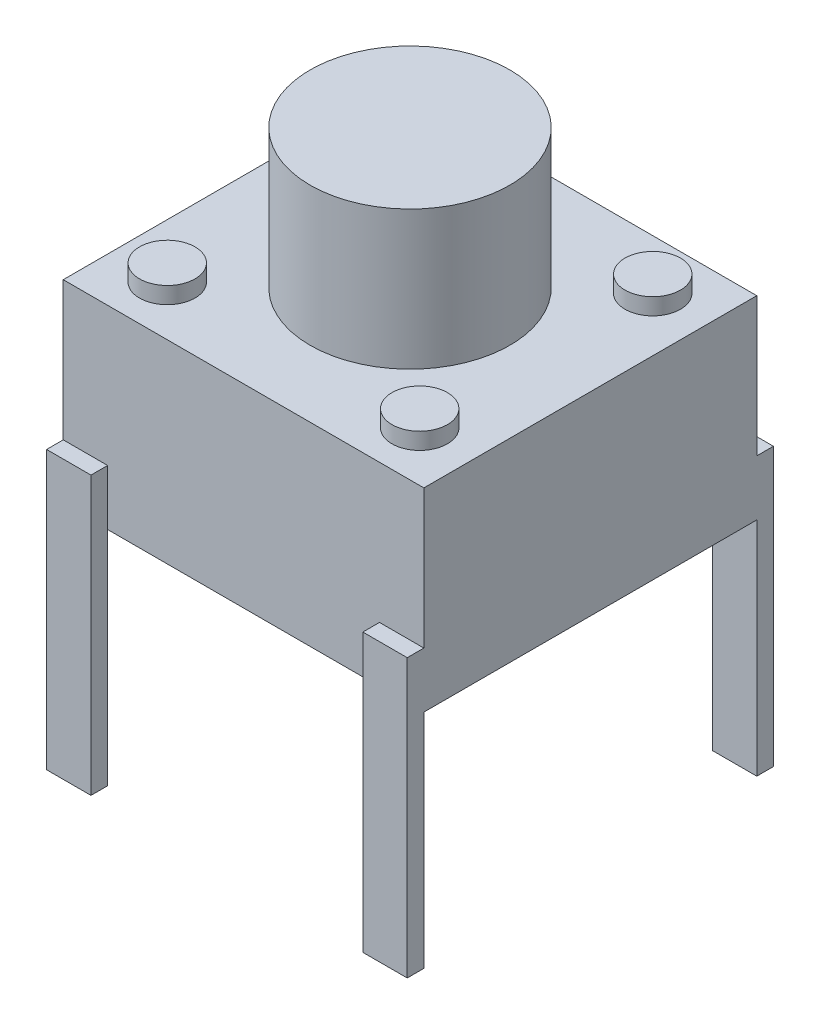
from build123d import *

# Parameters (mm, degrees)
SKETCH_1_W      = 6.5
SKETCH_1_H      = 6
EXTRUDE_1_DEPTH = 3.5
SKETCH_1_3_R    = 1.8
EXTRUDE_2_DEPTH = 6
EXTRUDE_START   = 3.5
SKETCH_1_4_R    = 0.5
EXTRUDE_3_DEPTH = 0.3
EXTRUDE_START_2 = -1
SKETCH_2_W      = 0.8
SKETCH_2_H      = 0.3
EXTRUDE_4_DEPTH = 5


with BuildPart() as part:
    # 草图1 → 凸台-拉伸1 (new body)
    with BuildSketch(Plane(origin=(0, 0, 0), x_dir=(1, 0, 0), z_dir=(0, 1, 0))):
        Rectangle(SKETCH_1_W, SKETCH_1_H)
    extrude(amount=EXTRUDE_1_DEPTH)

    # 草图1<3> → 凸台-拉伸2 (add)
    with BuildSketch(Plane(origin=(0, 0, 0), x_dir=(1, 0, 0), z_dir=(0, 1, 0))):
        with Locations(Location((0, 0, 0), (0, 0, 90))):
            Circle(SKETCH_1_3_R)
    extrude(amount=EXTRUDE_2_DEPTH)

    # 草图1<4> → 凸台-拉伸3 (add)
    with BuildSketch(Plane(origin=(0, 0, 0), x_dir=(1, 0, 0), z_dir=(0, 1, 0)).offset(EXTRUDE_START)):
        with Locations(Location((-2.275, 2.1, 0), (0, 0, 90))):
            Circle(SKETCH_1_4_R)
        with Locations(Location((-2.275, -2.1, 0), (0, 0, 90))):
            Circle(SKETCH_1_4_R)
        with Locations(Location((2.275, -2.1, 0), (0, 0, 90))):
            Circle(SKETCH_1_4_R)
        with Locations(Location((2.275, 2.1, 0), (0, 0, 90))):
            Circle(SKETCH_1_4_R)
    extrude(amount=EXTRUDE_3_DEPTH)

    # 草图2 → 凸台-拉伸4 (add)
    with BuildSketch(Plane.XZ.offset(EXTRUDE_START_2)):
        with Locations((-2.85, 3.15)):
            Rectangle(SKETCH_2_W, SKETCH_2_H)
        with Locations((2.85, 3.15)):
            Rectangle(SKETCH_2_W, SKETCH_2_H)
        with Locations((-2.85, -3.15)):
            Rectangle(SKETCH_2_W, SKETCH_2_H)
        with Locations((2.85, -3.15)):
            Rectangle(SKETCH_2_W, SKETCH_2_H)
    extrude(amount=EXTRUDE_4_DEPTH)


solid = part.part
